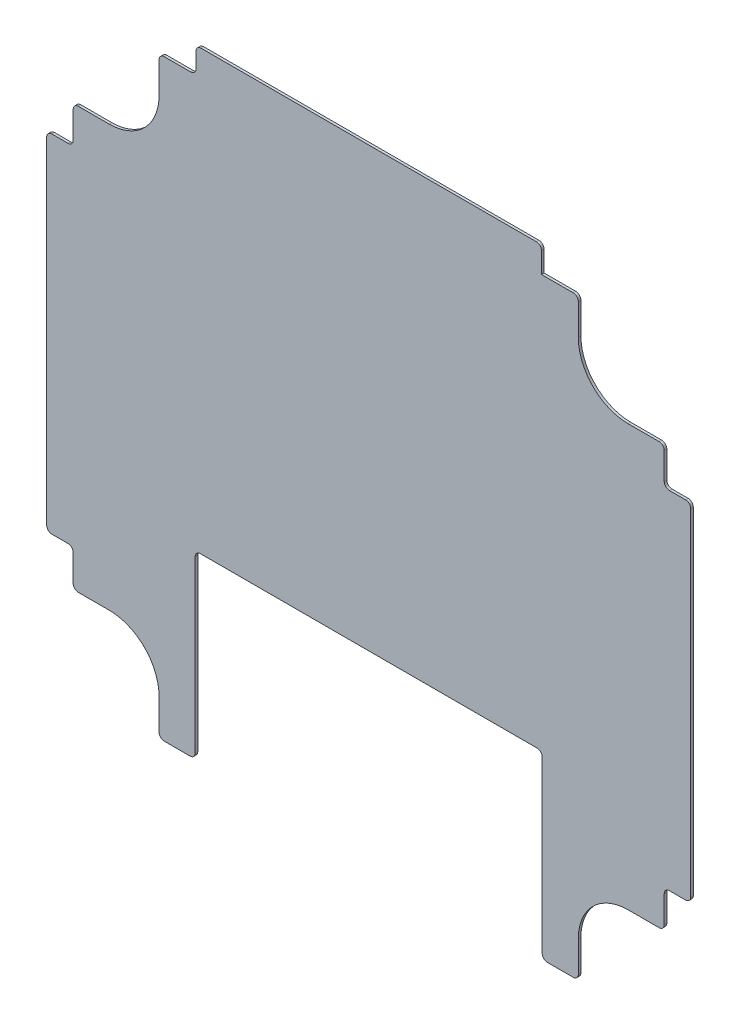
from build123d import *

# Parameters (mm, degrees)
RESSALTO_EXTRUS_O1_DEPTH = 3
FILETE1_R                = 6


with BuildPart() as part:
    # Esboço1 → Ressalto-extrusão1 (new body)
    with BuildSketch(Plane.XY):
        with BuildLine():
            Line((306.342806047, -674.493319609), (275.520600999, -674.493319609))
            Line((275.520600999, -674.493319609), (275.520600999, -717.778646353))
            Line((275.520600999, -717.778646353), (233.520600999, -717.778646353))
            ThreePointArc((233.520600999, -717.778646353), (192.534924195, -734.755469548), (175.558100999, -775.741146353))
            Line((175.558100999, -775.741146353), (175.558100999, -817.741146353))
            Line((175.558100999, -817.741146353), (133.558100999, -817.741146353))
            Line((133.558100999, -817.741146353), (133.558100999, -607.741146353))
            Line((133.558100999, -607.741146353), (-270.272488906, -607.741146353))
            Line((-270.272488906, -607.741146353), (-270.272488906, -817.741146353))
            Line((-270.272488906, -817.741146353), (-312.272488906, -817.741146353))
            Line((-312.272488906, -817.741146353), (-312.272488906, -775.741146353))
            ThreePointArc((-312.272488906, -775.741146353), (-329.249312101, -734.755469548), (-370.234988906, -717.778646353))
            Line((-370.234988906, -717.778646353), (-412.234988906, -717.778646353))
            Line((-412.234988906, -717.778646353), (-412.234988906, -674.493319609))
            Line((-412.234988906, -674.493319609), (-443.057193953, -674.493319609))
            Line((-443.057193953, -674.493319609), (-443.057193953, -271.188973097))
            Line((-443.057193953, -271.188973097), (-412.234988906, -271.188973097))
            Line((-412.234988906, -271.188973097), (-412.234988906, -227.903646353))
            Line((-412.234988906, -227.903646353), (-370.234988906, -227.903646353))
            ThreePointArc((-370.234988906, -227.903646353), (-329.249312101, -210.926823158), (-312.272488906, -169.941146353))
            Line((-312.272488906, -169.941146353), (-312.272488906, -127.941146353))
            Line((-312.272488906, -127.941146353), (-270.272488906, -127.941146353))
            Line((-270.272488906, -127.941146353), (-269.391871615, -127.941146353))
            Line((-269.391871615, -127.941146353), (-269.391871615, -97.941146353))
            Line((-269.391871615, -97.941146353), (132.677483708, -97.941146353))
            Line((132.677483708, -97.941146353), (132.677483708, -127.941146353))
            Line((132.677483708, -127.941146353), (133.558100999, -127.941146353))
            Line((133.558100999, -127.941146353), (175.558100999, -127.941146353))
            Line((175.558100999, -127.941146353), (175.558100999, -169.941146353))
            ThreePointArc((175.558100999, -169.941146353), (192.534924195, -210.926823158), (233.520600999, -227.903646353))
            Line((233.520600999, -227.903646353), (275.520600999, -227.903646353))
            Line((275.520600999, -227.903646353), (275.520600999, -271.188973097))
            Line((275.520600999, -271.188973097), (306.342806047, -271.188973097))
            Line((306.342806047, -271.188973097), (306.342806047, -674.493319609))
        make_face()
    extrude(amount=RESSALTO_EXTRUS_O1_DEPTH)

    # Filete1
    filete1_edges = [part.edges().sort_by_distance(p)[0] for p in [
        (306.342806047, -674.493319609, 1.5),
        (275.520600999, -674.493319609, 1.5),
        (275.520600999, -717.778646353, 1.5),
        (175.558100999, -817.741146353, 1.5),
        (133.558100999, -817.741146353, 1.5),
        (133.558100999, -607.741146353, 1.5),
        (-270.272488906, -607.741146353, 1.5),
        (-270.272488906, -817.741146353, 1.5),
        (-312.272488906, -817.741146353, 1.5),
        (-412.234988906, -717.778646353, 1.5),
        (-412.234988906, -674.493319609, 1.5),
        (-443.057193953, -674.493319609, 1.5),
        (-443.057193953, -271.188973097, 1.5),
        (-412.234988906, -271.188973097, 1.5),
        (-412.234988906, -227.903646353, 1.5),
        (-312.272488906, -127.941146353, 1.5),
        (-269.391871615, -127.941146353, 1.5),
        (-269.391871615, -97.941146353, 1.5),
        (132.677483708, -97.941146353, 1.5),
        (175.558100999, -127.941146353, 1.5),
        (275.520600999, -227.903646353, 1.5),
        (275.520600999, -271.188973097, 1.5),
        (306.342806047, -271.188973097, 1.5),
    ]]
    fillet(filete1_edges, radius=FILETE1_R)


solid = part.part
